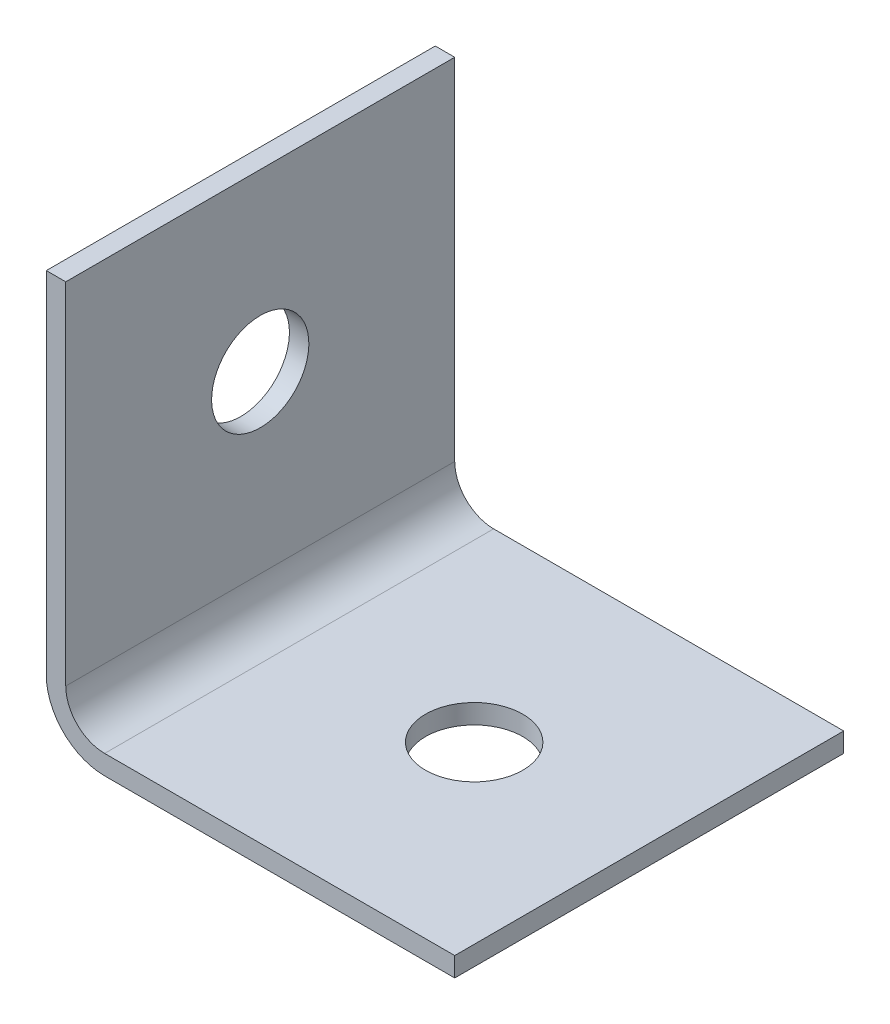
from build123d import *

# Parameters (mm, degrees)
EXTRUDE_THIN1_DEPTH = 20
FILLET1_R           = 3
FILLET3_R           = 2
SKETCH3_R           = 2.5
CUT_EXTRUDE1_DEPTH  = 10
SKETCH4_R           = 2.5
CUT_EXTRUDE2_DEPTH  = 10


with BuildPart() as part:
    # Sketch1 → Extrude-Thin1 (new body)
    with BuildSketch(Plane.XY):
        Polygon((0, 0), (0, -20), (20, -20), (20, -21), (-1, -21), (-1, 0), align=None)
    extrude(amount=EXTRUDE_THIN1_DEPTH)

    # Fillet1
    fillet1_edges = [part.edges().sort_by_distance(p)[0] for p in [
        (-1, -21, 10),
    ]]
    fillet(fillet1_edges, radius=FILLET1_R)

    # Fillet3
    fillet3_edges = [part.edges().sort_by_distance(p)[0] for p in [
        (0, -20, 10),
    ]]
    fillet(fillet3_edges, radius=FILLET3_R)

    # Sketch3 → Cut-Extrude1 (cut)
    with BuildSketch(Plane(origin=(0, 0, 0), x_dir=(0, 0, -1), z_dir=(1, 0, 0))):
        with Locations(Location((-10, -9, 0), (0, 0, 90))):
            Circle(SKETCH3_R)
    extrude(amount=-CUT_EXTRUDE1_DEPTH, mode=Mode.SUBTRACT)

    # Sketch4 → Cut-Extrude2 (cut)
    with BuildSketch(Plane(origin=(0, -20, 0), x_dir=(1, 0, 0), z_dir=(0, 1, 0))):
        with Locations(Location((11, -10, 0), (0, 0, 270))):
            Circle(SKETCH4_R)
    extrude(amount=-CUT_EXTRUDE2_DEPTH, mode=Mode.SUBTRACT)


solid = part.part
